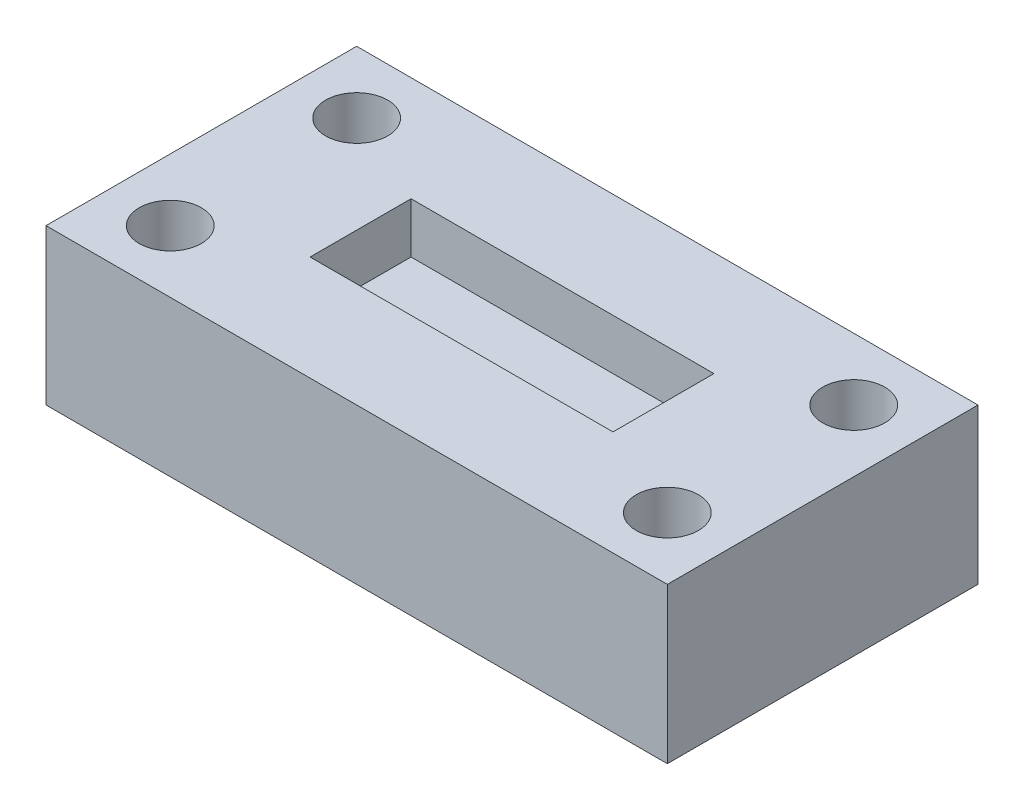
from build123d import *

# Parameters (mm, degrees)
SKETCH1_W           = 40
SKETCH1_H           = 20
SKETCH1_R           = 2
BOSS_EXTRUDE1_DEPTH = 5
SKETCH2_W           = 19.5
SKETCH2_H           = 6.5
CUT_EXTRUDE1_DEPTH  = 3.25


with BuildPart() as part:
    # Sketch1 → Boss-Extrude1 (new, symmetric)
    with BuildSketch(Plane(origin=(0, 0, 0), x_dir=(1, 0, 0), z_dir=(0, 1, 0))):
        Rectangle(SKETCH1_W, SKETCH1_H)
        with Locations(Location((-16, 6, 0), (0, 0, 270))):
            Circle(SKETCH1_R, mode=Mode.SUBTRACT)
        with Locations(Location((16, 6, 0), (0, 0, 270))):
            Circle(SKETCH1_R, mode=Mode.SUBTRACT)
        with Locations(Location((16, -6, 0), (0, 0, 270))):
            Circle(SKETCH1_R, mode=Mode.SUBTRACT)
        with Locations(Location((-16, -6, 0), (0, 0, 270))):
            Circle(SKETCH1_R, mode=Mode.SUBTRACT)
    extrude(amount=BOSS_EXTRUDE1_DEPTH, both=True)

    # Sketch2 → Cut-Extrude1 (cut, symmetric)
    with BuildSketch(Plane(origin=(0, 5, 0), x_dir=(1, 0, 0), z_dir=(0, 1, 0))):
        Rectangle(SKETCH2_W, SKETCH2_H)
    cut_extrude1 = extrude(amount=CUT_EXTRUDE1_DEPTH, both=True, mode=Mode.SUBTRACT)

    # Mirror1: Cut-Extrude1 across plane
    add(cut_extrude1.mirror(Plane.ZX), mode=Mode.SUBTRACT)


solid = part.part
